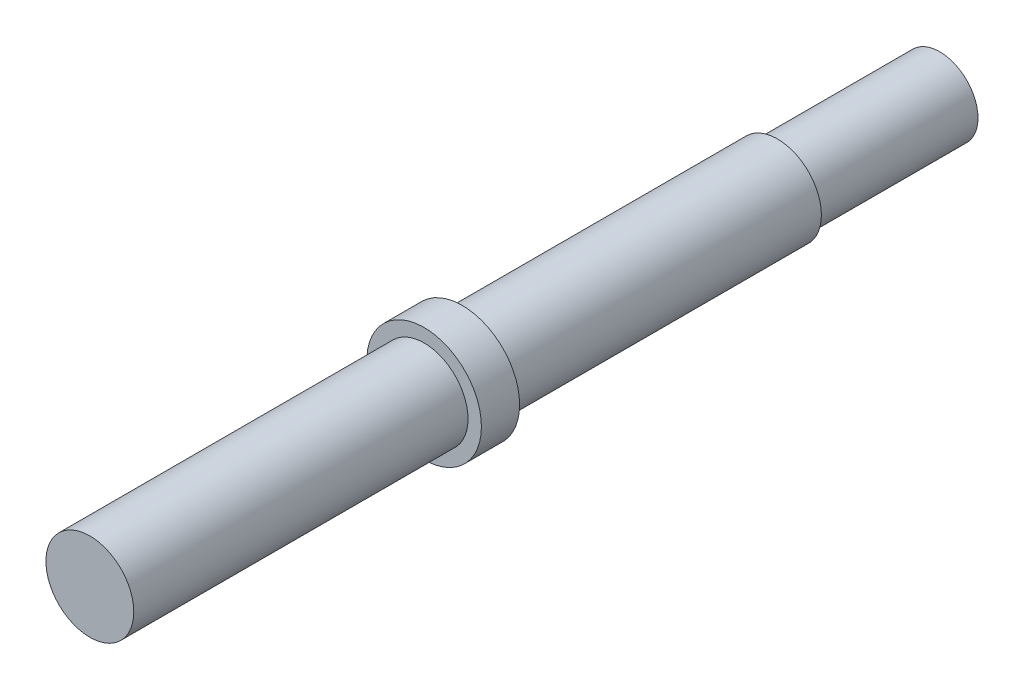
from build123d import *

# Parameters (mm, degrees)
BOSS_EXTRUDE1_START = 12
SKETCH1_R           = 4
BOSS_EXTRUDE1_DEPTH = 17
BOSS_EXTRUDE2_START = 12
SKETCH2_R           = 4.6
BOSS_EXTRUDE2_DEPTH = 72
BOSS_EXTRUDE3_START = 49
SKETCH3_R           = 6
BOSS_EXTRUDE3_DEPTH = 4


with BuildPart() as part:
    # Sketch1 → Boss-Extrude1 (new body)
    with BuildSketch(Plane.XY.offset(BOSS_EXTRUDE1_START)):
        Circle(SKETCH1_R)
    extrude(amount=-BOSS_EXTRUDE1_DEPTH)

    # Sketch2 → Boss-Extrude2 (add)
    with BuildSketch(Plane.XY.offset(BOSS_EXTRUDE2_START)):
        Circle(SKETCH2_R)
    extrude(amount=BOSS_EXTRUDE2_DEPTH)

    # Sketch3 → Boss-Extrude3 (add)
    with BuildSketch(Plane.XY.offset(BOSS_EXTRUDE3_START)):
        Circle(SKETCH3_R)
    extrude(amount=-BOSS_EXTRUDE3_DEPTH)


solid = part.part
